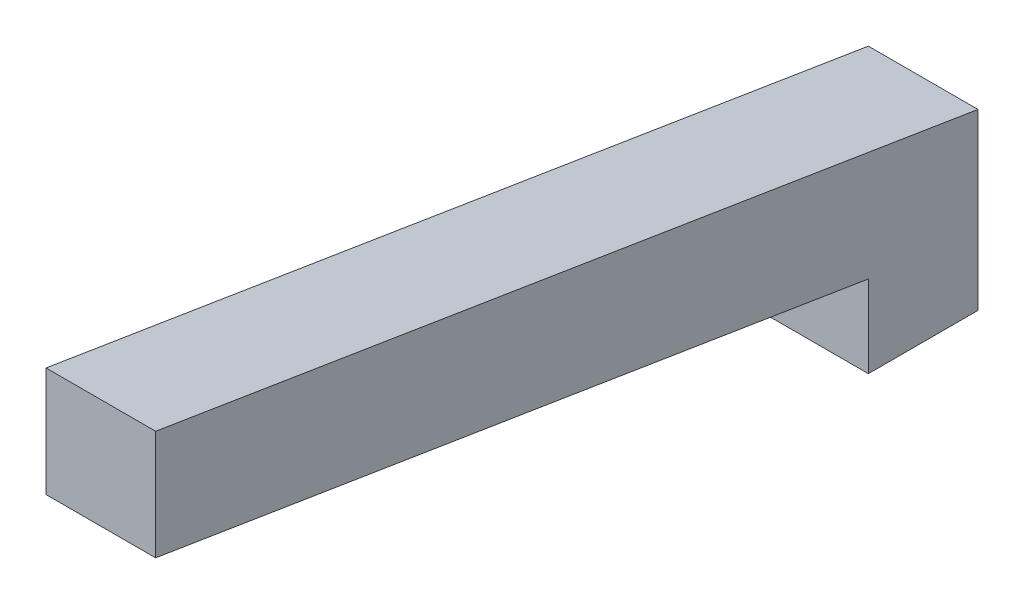
from build123d import *

# Parameters (mm, degrees)
BOSS_EXTRUDE1_DEPTH = 5.08


with BuildPart() as part:
    # Sketch2 → Boss-Extrude1 (new body)
    with BuildSketch(Plane(origin=(0, 0, 0), x_dir=(0, 0, -1), z_dir=(1, 0, 0))):
        Polygon((0, 0), (5.08, 0), (5.08, 8.063498442), (-33.02, 14.200428151), (-33.02, 9.120428151), (0, 3.801755737), align=None)
    extrude(amount=BOSS_EXTRUDE1_DEPTH)


solid = part.part
